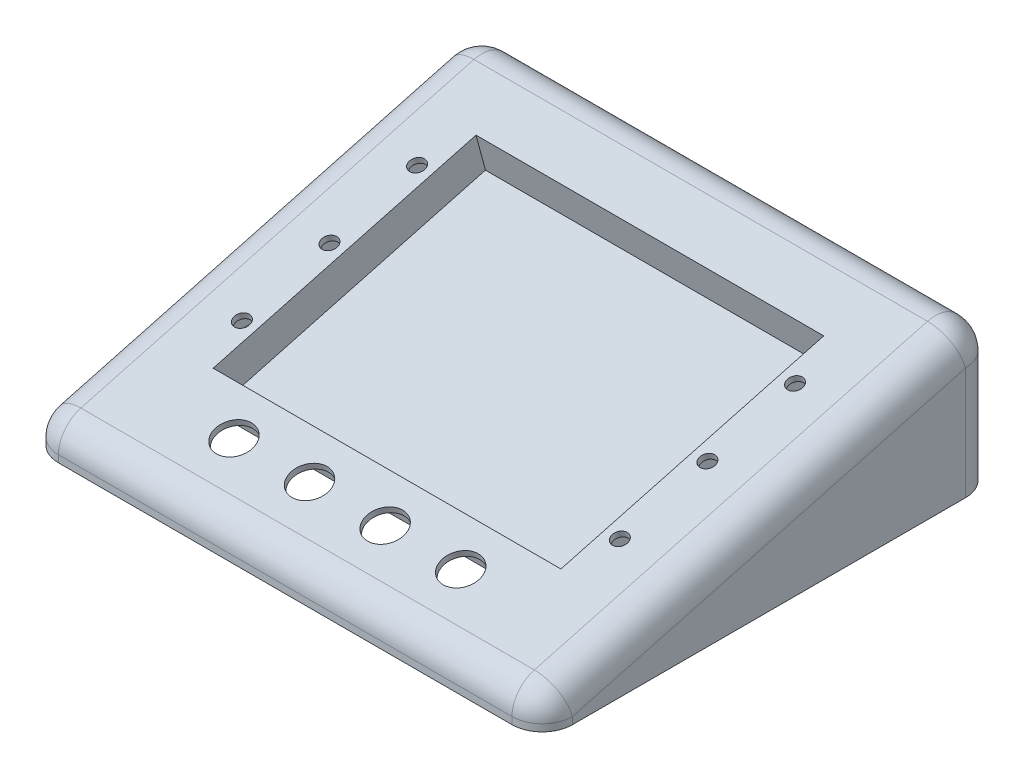
from build123d import *

# Parameters (mm, degrees)
SKETCH1_W                                  = 170
SKETCH1_H                                  = 150
BOSS_EXTRUDE1_DEPTH                        = 10
BOSS_EXTRUDE2_DEPTH                        = 170
FILLET1_R                                  = 10
SHELL1_T                                   = -2
SKETCH3_W                                  = 115
SKETCH3_H                                  = 90
CUT_EXTRUDE1_DEPTH                         = 2
SKETCH4_W                                  = 119
SKETCH4_H                                  = 94
SKETCH4_W_2                                = 115
SKETCH4_H_2                                = 90
BOSS_EXTRUDE3_DEPTH                        = 10
SKETCH5_W                                  = 119
SKETCH5_H                                  = 94
BOSS_EXTRUDE4_DEPTH                        = 2
SKETCH6_R                                  = 2.5
CUT_EXTRUDE2_DEPTH                         = 2
SKETCH7_R                                  = 6
CUT_EXTRUDE3_DEPTH                         = 2
SKETCH9_W                                  = 10
SKETCH9_H                                  = 15
BOSS_EXTRUDE5_DEPTH                        = 10
SKETCH10_W                                 = 5
SKETCH10_H                                 = 10
CUT_EXTRUDE4_DEPTH                         = 5
MIRROR1_AT_THE_SECOND_PLANE_COPY_1_SKETC_W = 10
MIRROR1_AT_THE_SECOND_PLANE_COPY_1_SKETC_H = 15
MIRROR1_AT_THE_SECOND_PLANE_COPY_1_DEPTH   = 10
MIRROR1_AT_THE_SECOND_PLANE_COPY_2_SKETC_W = 5
MIRROR1_AT_THE_SECOND_PLANE_COPY_2_SKETC_H = 10
MIRROR1_AT_THE_SECOND_PLANE_COPY_2_DEPTH   = 5
FILLET2_R                                  = 2


with BuildPart() as part:
    # Sketch1 → Boss-Extrude1 (new body)
    with BuildSketch(Plane(origin=(0, 0, 0), x_dir=(1, 0, 0), z_dir=(0, 1, 0))):
        Rectangle(SKETCH1_W, SKETCH1_H)
    extrude(amount=BOSS_EXTRUDE1_DEPTH)

    # Sketch2 → Boss-Extrude2 (add)
    with BuildSketch(Plane.ZY.offset(85)):
        Polygon((-75, 10), (-75, 50.192378865), (75, 10), align=None)
    extrude(amount=-BOSS_EXTRUDE2_DEPTH)

    # Fillet1
    fillet1_edges = [part.edges().sort_by_distance(p)[0] for p in [
        (0, 50.192378865, -75),
        (-85, 30.096189432, 0),
        (85, 30.096189432, 0),
        (0, 10, 75),
        (85, 5, 75),
        (-85, 5, 75),
        (-85, 25.096189432, -75),
        (85, 25.096189432, -75),
    ]]
    fillet(fillet1_edges, radius=FILLET1_R)

    # Shell1
    shell1_openings = [part.faces().sort_by_distance(p)[0] for p in [
        (0, 0, 0),
    ]]
    offset(amount=SHELL1_T, openings=shell1_openings, kind=Kind.INTERSECTION)

    # Sketch3 → Cut-Extrude1 (cut)
    with BuildSketch(Plane(origin=(0, 28.080127019, 7.524047358), x_dir=(1, 0, 0), z_dir=(0, 0.96592582628907, 0.25881904510251436))):
        with Locations((0, 10)):
            Rectangle(SKETCH3_W, SKETCH3_H)
    extrude(amount=-CUT_EXTRUDE1_DEPTH, mode=Mode.SUBTRACT)

    # Sketch4 → Boss-Extrude3 (add)
    with BuildSketch(Plane(origin=(0, 26.148275366, 7.006409268), x_dir=(1, 0, 0), z_dir=(0, -0.96592582628907, -0.25881904510251436))):
        with Locations((0, -10)):
            Rectangle(SKETCH4_W, SKETCH4_H)
        with Locations((0, -10)):
            Rectangle(SKETCH4_W_2, SKETCH4_H_2, mode=Mode.SUBTRACT)
    extrude(amount=BOSS_EXTRUDE3_DEPTH)

    # Sketch5 → Boss-Extrude4 (add)
    with BuildSketch(Plane(origin=(0, 16.489017103, 4.418218817), x_dir=(1, 0, 0), z_dir=(0, -0.96592582628907, -0.25881904510251436))):
        with Locations((0, -10)):
            Rectangle(SKETCH5_W, SKETCH5_H)
    extrude(amount=BOSS_EXTRUDE4_DEPTH)

    # Sketch6 → Cut-Extrude2 (cut)
    with BuildSketch(Plane(origin=(0, 28.080127019, 7.524047358), x_dir=(1, 0, 0), z_dir=(0, 0.96592582628907, 0.25881904510251436))):
        with Locations(Location((-62.5, 10, 0), (0, 0, 270))):
            Circle(SKETCH6_R)
        with Locations(Location((-62.5, 40, 0), (0, 0, 270))):
            Circle(SKETCH6_R)
        with Locations(Location((-62.5, -20, 0), (0, 0, 270))):
            Circle(SKETCH6_R)
        with Locations(Location((62.5, -20, 0), (0, 0, 270))):
            Circle(SKETCH6_R)
        with Locations(Location((62.5, 40, 0), (0, 0, 270))):
            Circle(SKETCH6_R)
        with Locations(Location((62.5, 10, 0), (0, 0, 270))):
            Circle(SKETCH6_R)
    extrude(amount=-CUT_EXTRUDE2_DEPTH, mode=Mode.SUBTRACT)

    # Sketch7 → Cut-Extrude3 (cut)
    with BuildSketch(Plane(origin=(0, 28.080127019, 7.524047358), x_dir=(1, 0, 0), z_dir=(0, 0.96592582628907, 0.25881904510251436))):
        with Locations(Location((-12.5, -48.59148832, 0), (0, 0, 270))):
            Circle(SKETCH7_R)
        with Locations(Location((12.5, -48.59148832, 0), (0, 0, 270))):
            Circle(SKETCH7_R)
        with Locations(Location((37.5, -48.59148832, 0), (0, 0, 270))):
            Circle(SKETCH7_R)
        with Locations(Location((-37.5, -48.59148832, 0), (0, 0, 270))):
            Circle(SKETCH7_R)
    extrude(amount=-CUT_EXTRUDE3_DEPTH, mode=Mode.SUBTRACT)

    # Sketch9 → Boss-Extrude5 (add)
    with BuildSketch(Plane.XZ):
        with Locations((-78, -47.5)):
            Rectangle(SKETCH9_W, SKETCH9_H)
    boss_extrude5 = extrude(amount=-BOSS_EXTRUDE5_DEPTH)

    # Sketch10 → Cut-Extrude4 (cut)
    with BuildSketch(Plane.XZ):
        with Locations((-78, -47.5)):
            Rectangle(SKETCH10_W, SKETCH10_H)
    cut_extrude4 = extrude(amount=-CUT_EXTRUDE4_DEPTH, mode=Mode.SUBTRACT)

    # Mirror1: Boss-Extrude5, Cut-Extrude4 across plane
    add(boss_extrude5.mirror(Plane(origin=(0, 0, 0), x_dir=(0, 0, 1), z_dir=(1, 0, 0))))
    add(cut_extrude4.mirror(Plane(origin=(0, 0, 0), x_dir=(0, 0, 1), z_dir=(1, 0, 0))), mode=Mode.SUBTRACT)

    # Mirror1 at the second plane: Boss-Extrude5, Cut-Extrude4 across plane
    add(boss_extrude5.mirror(Plane.XY))
    add(cut_extrude4.mirror(Plane.XY), mode=Mode.SUBTRACT)

    # Mirror1 at the second plane copy 1 sketc → Mirror1 at the second plane copy 1 (add)
    with BuildSketch(Plane(origin=(0, 0, 0), x_dir=(-1, 0, 0), z_dir=(0, -1, 0))):
        with Locations((-78, -47.5)):
            Rectangle(MIRROR1_AT_THE_SECOND_PLANE_COPY_1_SKETC_W, MIRROR1_AT_THE_SECOND_PLANE_COPY_1_SKETC_H)
    extrude(amount=-MIRROR1_AT_THE_SECOND_PLANE_COPY_1_DEPTH)

    # Mirror1 at the second plane copy 2 sketc → Mirror1 at the second plane copy 2 (cut)
    with BuildSketch(Plane(origin=(0, 0, 0), x_dir=(-1, 0, 0), z_dir=(0, -1, 0))):
        with Locations((-78, -47.5)):
            Rectangle(MIRROR1_AT_THE_SECOND_PLANE_COPY_2_SKETC_W, MIRROR1_AT_THE_SECOND_PLANE_COPY_2_SKETC_H)
    extrude(amount=-MIRROR1_AT_THE_SECOND_PLANE_COPY_2_DEPTH, mode=Mode.SUBTRACT)

    # Fillet2
    fillet2_edges = [part.edges().sort_by_distance(p)[0] for p in [
        (-73, 5, -40),
        (-73, 5, -55),
        (-73, 5, 40),
        (-73, 5, 55),
        (73, 5, -55),
        (73, 5, -40),
        (73, 5, 55),
        (73, 5, 40),
    ]]
    fillet(fillet2_edges, radius=FILLET2_R)


solid = part.part
